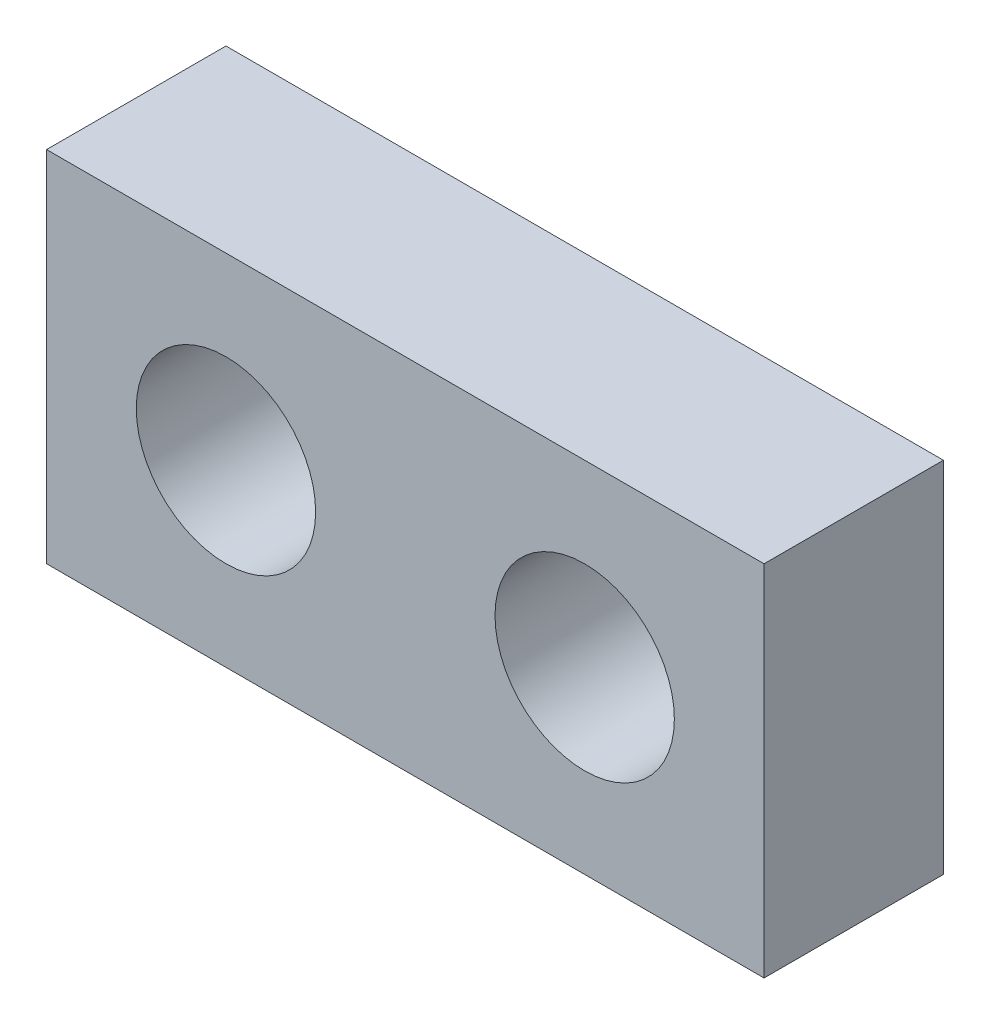
from build123d import *

# Parameters (mm, degrees)
SKETCH_1_W      = 20
SKETCH_1_H      = 10
SKETCH_1_R      = 2.5
EXTRUDE_1_DEPTH = 5


with BuildPart() as part:
    # 草图1 → 凸台-拉伸1 (new body)
    with BuildSketch(Plane.XY):
        Rectangle(SKETCH_1_W, SKETCH_1_H)
        with Locations((-5, 0)):
            Circle(SKETCH_1_R, mode=Mode.SUBTRACT)
        with Locations((5, 0)):
            Circle(SKETCH_1_R, mode=Mode.SUBTRACT)
    extrude(amount=EXTRUDE_1_DEPTH)


solid = part.part
